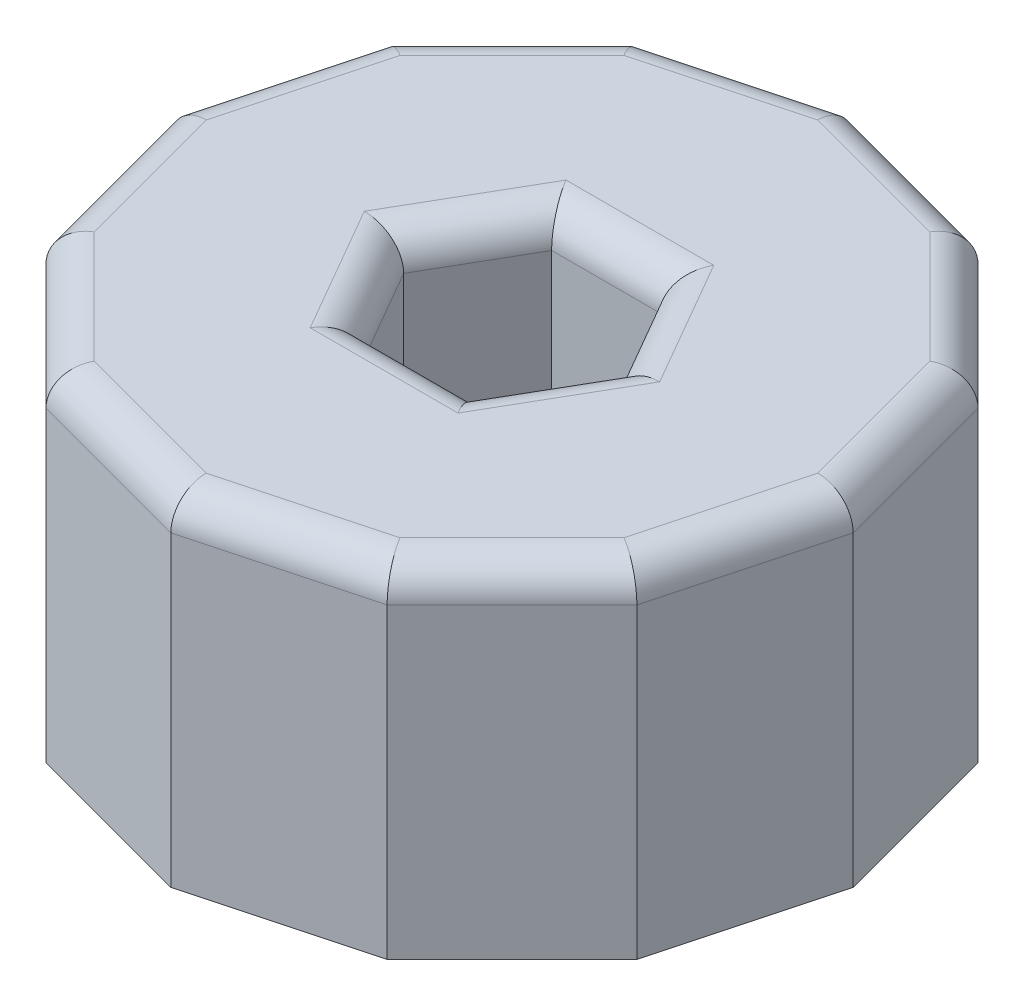
from build123d import *

# Parameters (mm, degrees)
SKETCH1_R           = 1.6
BOSS_EXTRUDE1_DEPTH = 10
CUT_EXTRUDE1_DEPTH  = 5
FILLET1_R           = 1


with BuildPart() as part:
    # Sketch1 → Boss-Extrude1 (new body)
    with BuildSketch(Plane(origin=(0, 0, 0), x_dir=(1, 0, 0), z_dir=(0, 1, 0))):
        Polygon((-10, 0), (-8.660254038, -5), (-5, -8.660254038), (0, -10), (5, -8.660254038), (8.660254038, -5), (10, 0), (8.660254038, 5), (5, 8.660254038), (0, 10), (-5, 8.660254038), (-8.660254038, 5), align=None)
        with Locations(Location((0, 0, 0), (0, 0, 270))):
            Circle(SKETCH1_R, mode=Mode.SUBTRACT)
    extrude(amount=BOSS_EXTRUDE1_DEPTH)

    # Sketch2 → Cut-Extrude1 (cut)
    with BuildSketch(Plane(origin=(0, 10, 0), x_dir=(1, 0, 0), z_dir=(0, 1, 0))):
        Polygon((3.175426481, 0), (1.58771324, 2.75), (-1.58771324, 2.75), (-3.175426481, 0), (-1.58771324, -2.75), (1.58771324, -2.75), align=None)
    extrude(amount=-CUT_EXTRUDE1_DEPTH, mode=Mode.SUBTRACT)

    # Fillet1
    fillet1_edges = [part.edges().sort_by_distance(p)[0] for p in [
        (9.330127019, 10, -2.5),
        (6.830127019, 10, -6.830127019),
        (2.5, 10, -9.330127019),
        (-2.5, 10, -9.330127019),
        (-6.830127019, 10, -6.830127019),
        (-9.330127019, 10, -2.5),
        (-9.330127019, 10, 2.5),
        (-6.830127019, 10, 6.830127019),
        (-2.5, 10, 9.330127019),
        (2.38156986, 10, 1.375),
        (2.38156986, 10, -1.375),
        (0, 10, -2.75),
        (-2.38156986, 10, -1.375),
        (-2.38156986, 10, 1.375),
        (0, 10, 2.75),
        (2.5, 10, 9.330127019),
        (6.830127019, 10, 6.830127019),
        (9.330127019, 10, 2.5),
    ]]
    fillet(fillet1_edges, radius=FILLET1_R)


solid = part.part
